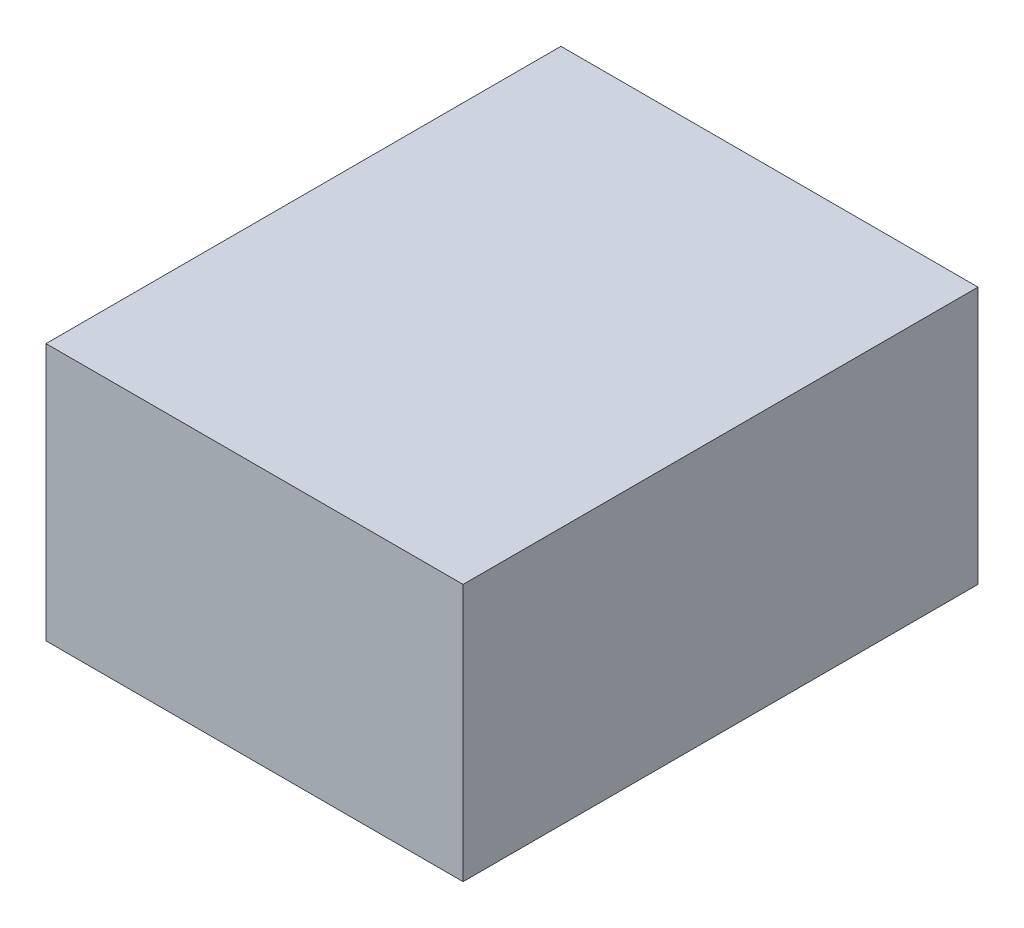
from build123d import *

# Parameters (mm, degrees)
SKETCH1_W           = 16.2
SKETCH1_H           = 20
BOSS_EXTRUDE1_DEPTH = 10


with BuildPart() as part:
    # Sketch1 → Boss-Extrude1 (new body)
    with BuildSketch(Plane(origin=(0, 0, 0), x_dir=(1, 0, 0), z_dir=(0, 1, 0))):
        with Locations((8.1, 10)):
            Rectangle(SKETCH1_W, SKETCH1_H)
    extrude(amount=-BOSS_EXTRUDE1_DEPTH)


solid = part.part
